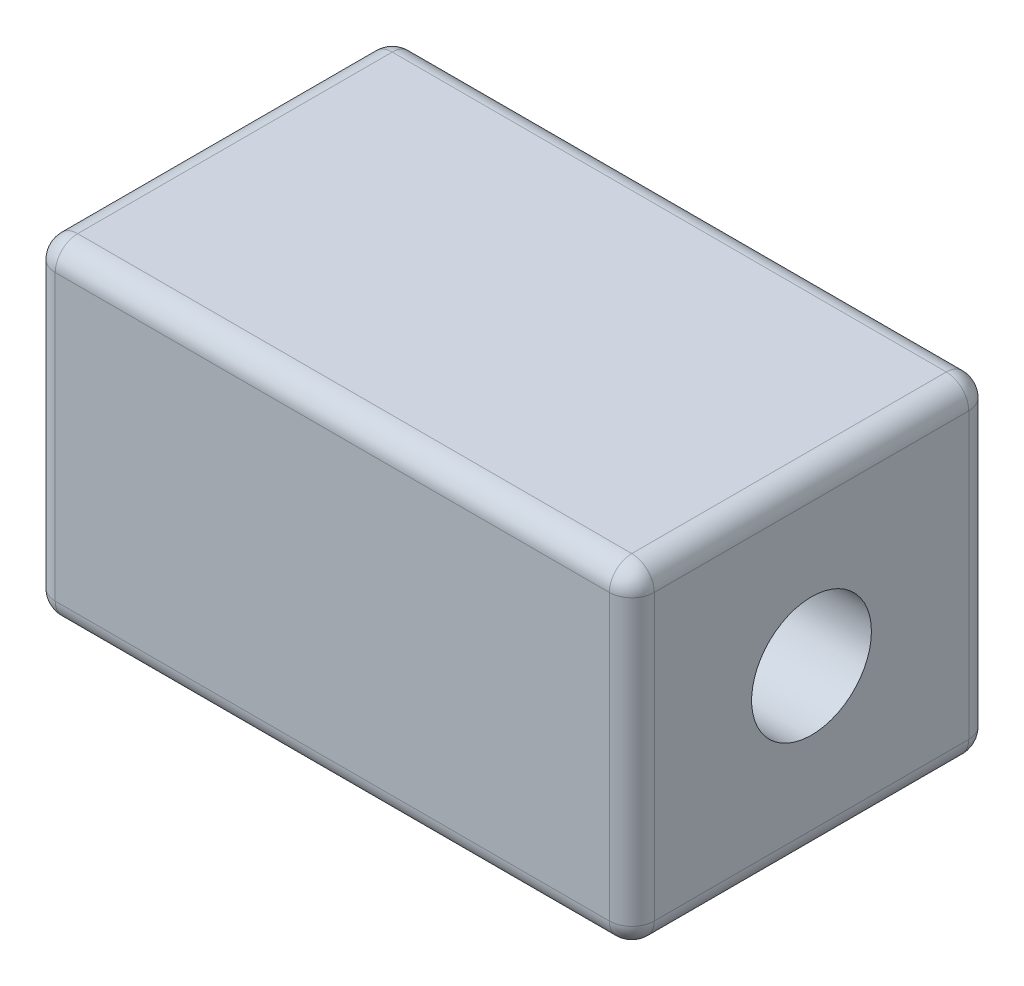
from build123d import *

# Parameters (mm, degrees)
SKETCH1_W                      = 20
SKETCH1_H                      = 12
BOSS_EXTRUDE1_DEPTH            = 11
F_1_5_1_5_DIAMETER_HOLE1_D     = 1.5
F_1_5_1_5_DIAMETER_HOLE1_DEPTH = 5.4
F_1_5_1_5_DIAMETER_HOLE1_TIP   = 0.450645464
SKETCH6_R                      = 2
CUT_EXTRUDE1_DEPTH             = 24.600847442
FILLET1_R                      = 0.75


with BuildPart() as part:
    # Sketch1 → Boss-Extrude1 (new body)
    with BuildSketch(Plane(origin=(0, 0, 0), x_dir=(1, 0, 0), z_dir=(0, 1, 0))):
        Rectangle(SKETCH1_W, SKETCH1_H)
    extrude(amount=BOSS_EXTRUDE1_DEPTH)

    # Ø1.5 (1.5) Diameter Hole1
    with Locations(Plane(origin=(0, 0, 0), x_dir=(-1, 0, 0), z_dir=(0, -1, 0))):
        with Locations((-5, 3), (5, -3)):
            Hole(F_1_5_1_5_DIAMETER_HOLE1_D / 2, depth=F_1_5_1_5_DIAMETER_HOLE1_DEPTH)
            with Locations((0, 0, -(F_1_5_1_5_DIAMETER_HOLE1_DEPTH + F_1_5_1_5_DIAMETER_HOLE1_TIP / 2))):  # 118° drill point
                Cone(0, F_1_5_1_5_DIAMETER_HOLE1_D / 2, F_1_5_1_5_DIAMETER_HOLE1_TIP, mode=Mode.SUBTRACT)

    # Sketch6 → Cut-Extrude1 (cut, through all)
    with BuildSketch(Plane(origin=(10, 0, 0), x_dir=(0, 0, -1), z_dir=(1, 0, 0))):
        with Locations((0, 5.5)):
            Circle(SKETCH6_R)
    extrude(amount=-CUT_EXTRUDE1_DEPTH, mode=Mode.SUBTRACT)

    # Fillet1
    fillet1_edges = [part.edges().sort_by_distance(p)[0] for p in [
        (-10, 11, 0),
        (0, 11, 6),
        (10, 11, 0),
        (0, 0, 6),
        (-10, 0, 0),
        (0, 0, -6),
        (10, 0, 0),
        (0, 11, -6),
        (10, 5.5, 6),
        (-10, 5.5, 6),
        (-10, 5.5, -6),
        (10, 5.5, -6),
    ]]
    fillet(fillet1_edges, radius=FILLET1_R)


solid = part.part
